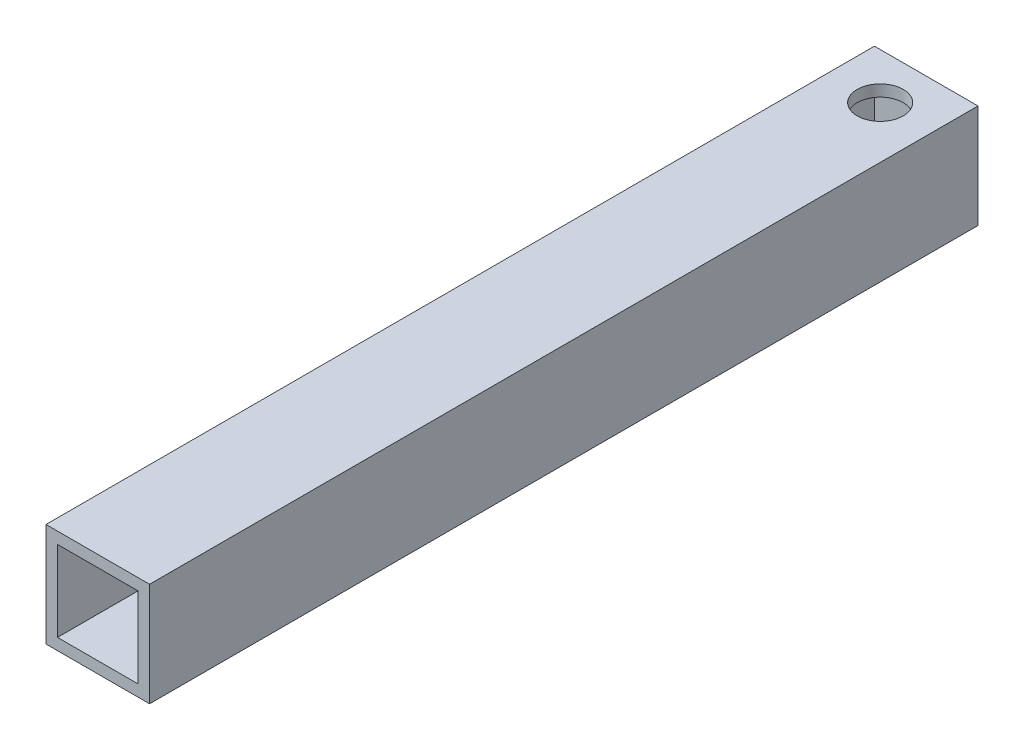
from build123d import *

# Parameters (mm, degrees)
SKETCH1_W           = 57.15
SKETCH1_H           = 57.15
SKETCH1_W_2         = 44.45
SKETCH1_H_2         = 44.45
BOSS_EXTRUDE1_DEPTH = 457.2
SKETCH2_W           = 44.45
SKETCH2_H           = 6.35
BOSS_EXTRUDE2_DEPTH = 44.45
SKETCH3_R           = 12.7
CUT_EXTRUDE1_DEPTH  = 6.35


with BuildPart() as part:
    # Sketch1 → Boss-Extrude1 (new body)
    with BuildSketch(Plane.XY):
        Rectangle(SKETCH1_W, SKETCH1_H)
        Rectangle(SKETCH1_W_2, SKETCH1_H_2, mode=Mode.SUBTRACT)
    extrude(amount=BOSS_EXTRUDE1_DEPTH)

    # Sketch2 → Boss-Extrude2 (add)
    with BuildSketch(Plane(origin=(0, -22.225, 0), x_dir=(1, 0, 0), z_dir=(0, 1, 0))):
        with Locations((0, -3.175)):
            Rectangle(SKETCH2_W, SKETCH2_H)
    extrude(amount=BOSS_EXTRUDE2_DEPTH)

    # Sketch3 → Cut-Extrude1 (cut)
    with BuildSketch(Plane(origin=(0, 28.575, 0), x_dir=(0, 0, -1), z_dir=(0, 1, 0))):
        with Locations(Location((-25.4, 0, 0), (0, 0, 180))):
            Circle(SKETCH3_R)
    extrude(amount=-CUT_EXTRUDE1_DEPTH, mode=Mode.SUBTRACT)


solid = part.part
